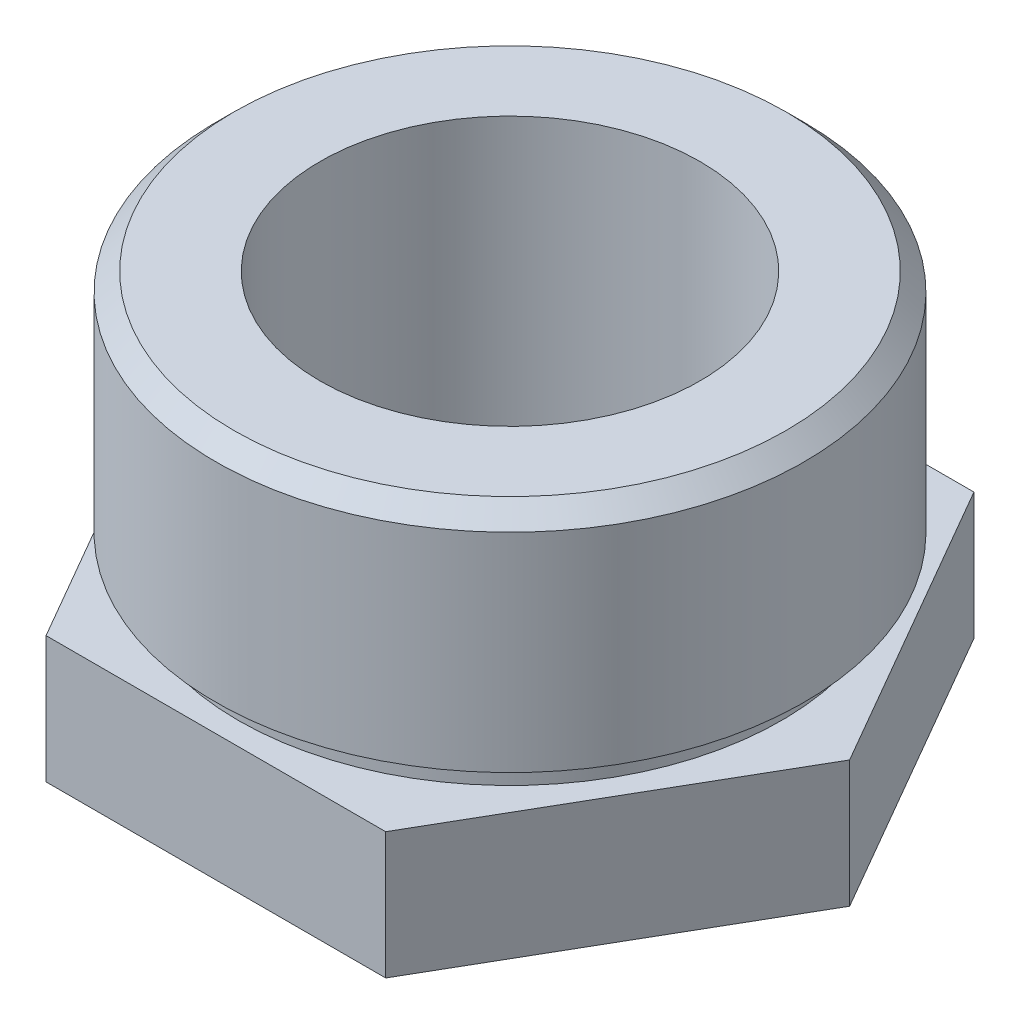
from build123d import *

# Parameters (mm, degrees)
SKETCH1_R           = 30
SKETCH1_R_2         = 21
BOSS_EXTRUDE1_DEPTH = 14
SKETCH1_3_R         = 32.5
SKETCH1_3_R_2       = 30
SKETCH1_3_R_3       = 21
BOSS_EXTRUDE2_DEPTH = 42
CUT_EXTRUDE1_START  = 14
SKETCH1_4_R         = 32.5
SKETCH1_4_R_2       = 30
CUT_EXTRUDE1_DEPTH  = 3
CHAMFER2_SIZE       = 2


with BuildPart() as part:
    # Sketch1 → Boss-Extrude1 (new body)
    # profile 1 of 8: a face of its own
    with BuildSketch(Plane(origin=(0, 0, 0), x_dir=(1, 0, 0), z_dir=(0, 1, 0))):
        Polygon((-18.763883749, -32.5), (18.763883749, -32.5), (37.527767497, 0), (18.763883749, 32.5), (-18.763883749, 32.5), (-37.527767497, 0), align=None)
        Circle(SKETCH1_R, mode=Mode.SUBTRACT)
    # profile 2 of 8: a face of its own
    with BuildSketch(Plane(origin=(0, 0, 0), x_dir=(1, 0, 0), z_dir=(0, 1, 0))):
        Circle(SKETCH1_R)
        with Locations(Location((0, 0, 0), (0, 0, 270))):
            Circle(SKETCH1_R_2, mode=Mode.SUBTRACT)
    # profile 3 of 8: a face of its own
    with BuildSketch(Plane(origin=(0, 0, 0), x_dir=(1, 0, 0), z_dir=(0, 1, 0))):
        with BuildLine():
            ThreePointArc((-5.3e-08, 32.5), (16.250000065, 28.145825585), (28.145825725, 16.249999824))
            Line((28.145825725, 16.249999824), (18.763883749, 32.5))
            Line((18.763883749, 32.5), (-5.3e-08, 32.5))
        make_face()
    # profile 4 of 8: a face of its own
    with BuildSketch(Plane(origin=(0, 0, 0), x_dir=(1, 0, 0), z_dir=(0, 1, 0))):
        with BuildLine():
            ThreePointArc((-28.14582555, 16.250000126), (-16.24999996, 28.145825646), (-5.3e-08, 32.5))
            Line((-5.3e-08, 32.5), (-18.763883749, 32.5))
            Line((-18.763883749, 32.5), (-28.14582555, 16.250000126))
        make_face()
    # profile 5 of 8: a face of its own
    with BuildSketch(Plane(origin=(0, 0, 0), x_dir=(1, 0, 0), z_dir=(0, 1, 0))):
        with BuildLine():
            Line((28.145825318, -16.250000528), (37.527767497, 0))
            Line((37.527767497, 0), (28.145825725, 16.249999824))
            ThreePointArc((28.145825725, 16.249999824), (31.392589381, 8.411618868), (32.5, 0))
            ThreePointArc((32.5, 0), (31.392589275, -8.41161926), (28.145825318, -16.250000528))
        make_face()
    # profile 6 of 8: a face of its own
    with BuildSketch(Plane(origin=(0, 0, 0), x_dir=(1, 0, 0), z_dir=(0, 1, 0))):
        with BuildLine():
            Line((18.763883749, -32.5), (28.145825318, -16.250000528))
            ThreePointArc((28.145825318, -16.250000528), (16.249999715, -28.145825788), (-4.8e-08, -32.5))
            Line((-4.8e-08, -32.5), (18.763883749, -32.5))
        make_face()
    # profile 7 of 8: a face of its own
    with BuildSketch(Plane(origin=(0, 0, 0), x_dir=(1, 0, 0), z_dir=(0, 1, 0))):
        with BuildLine():
            Line((-18.763883749, -32.5), (-4.8e-08, -32.5))
            ThreePointArc((-4.8e-08, -32.5), (-16.250000055, -28.145825591), (-28.145825663, -16.249999931))
            Line((-28.145825663, -16.249999931), (-18.763883749, -32.5))
        make_face()
    # profile 8 of 8: a face of its own
    with BuildSketch(Plane(origin=(0, 0, 0), x_dir=(1, 0, 0), z_dir=(0, 1, 0))):
        with BuildLine():
            ThreePointArc((-28.145825663, -16.249999931), (-32.5, 1.12e-07), (-28.14582555, 16.250000126))
            Line((-28.14582555, 16.250000126), (-37.527767497, 0))
            Line((-37.527767497, 0), (-28.145825663, -16.249999931))
        make_face()
    extrude(amount=BOSS_EXTRUDE1_DEPTH)

    # Sketch1<3> → Boss-Extrude2 (add)
    # profile 1 of 2: a face of its own
    with BuildSketch(Plane(origin=(0, 0, 0), x_dir=(1, 0, 0), z_dir=(0, 1, 0))):
        with Locations(Location((0, 0, 0), (0, 0, 270))):
            Circle(SKETCH1_3_R)
        Circle(SKETCH1_3_R_2, mode=Mode.SUBTRACT)
    # profile 2 of 2: a face of its own
    with BuildSketch(Plane(origin=(0, 0, 0), x_dir=(1, 0, 0), z_dir=(0, 1, 0))):
        Circle(SKETCH1_3_R_2)
        with Locations(Location((0, 0, 0), (0, 0, 270))):
            Circle(SKETCH1_3_R_3, mode=Mode.SUBTRACT)
    extrude(amount=BOSS_EXTRUDE2_DEPTH)

    # Sketch1<4> → Cut-Extrude1 (cut)
    with BuildSketch(Plane(origin=(0, 0, 0), x_dir=(1, 0, 0), z_dir=(0, 1, 0)).offset(CUT_EXTRUDE1_START)):
        with Locations(Location((0, 0, 0), (0, 0, 90))):
            Circle(SKETCH1_4_R)
        with Locations(Location((0, 0, 0), (0, 0, 270))):
            Circle(SKETCH1_4_R_2, mode=Mode.SUBTRACT)
    extrude(amount=CUT_EXTRUDE1_DEPTH, mode=Mode.SUBTRACT)

    # Chamfer2
    chamfer2_edges = [part.edges().sort_by_distance(p)[0] for p in [
        (0, 42, -32.5),
    ]]
    chamfer(chamfer2_edges, length=CHAMFER2_SIZE)


solid = part.part
